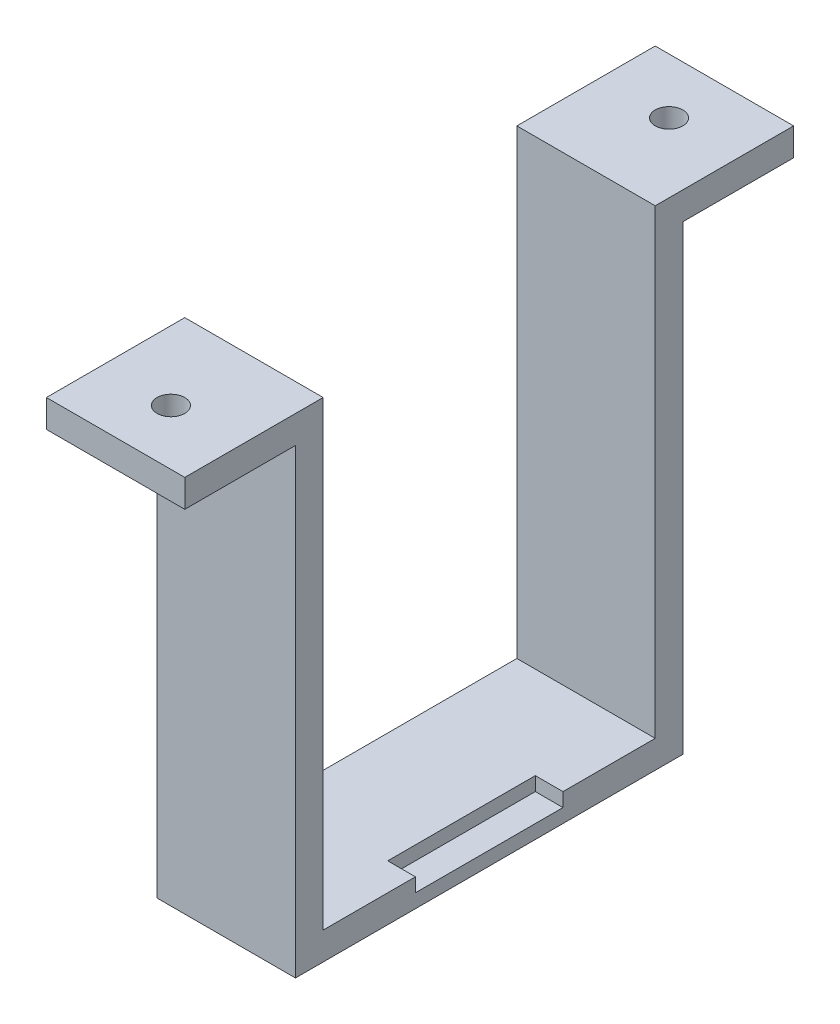
from build123d import *

# Parameters (mm, degrees)
EXTRUDE_1_DEPTH     = 15
CUT_EXTRUDE_1_REACH = 63.758
SKETCH_2_R          = 1.5
SKETCH_3_W          = 16
SKETCH_3_H          = 1.5
CUT_EXTRUDE_2_DEPTH = 3


with BuildPart() as part:
    # 草图1 → 凸台-拉伸1 (new body)
    with BuildSketch(Plane(origin=(0, 0, 0), x_dir=(0, 0, -1), z_dir=(1, 0, 0))):
        Polygon((0, 0), (18, 0), (18, 50), (33, 50), (33, 47), (21, 47), (21, -3), (0, -3), (-21, -3), (-21, 47), (-33, 47), (-33, 50), (-18, 50), (-18, 0), align=None)
    extrude(amount=EXTRUDE_1_DEPTH)

    # 草图2 → 切除-拉伸1 (cut, up to next)
    with BuildSketch(Plane.XZ.offset(-47), mode=Mode.PRIVATE) as cut_extrude_1_sk1:
        with Locations(Location((7.5, -27, 0), (0, 0, 270))):
            Circle(SKETCH_2_R)
    cut_extrude_1_tool1 = extrude(cut_extrude_1_sk1.sketch, amount=-CUT_EXTRUDE_1_REACH, mode=Mode.PRIVATE) & part.part
    # 草图2 → 切除-拉伸1 (cut, up to next)
    with BuildSketch(Plane.XZ.offset(-47), mode=Mode.PRIVATE) as cut_extrude_1_sk2:
        with Locations(Location((7.5, 27, 0), (0, 0, 270))):
            Circle(SKETCH_2_R)
    cut_extrude_1_tool2 = extrude(cut_extrude_1_sk2.sketch, amount=-CUT_EXTRUDE_1_REACH, mode=Mode.PRIVATE) & part.part
    add(cut_extrude_1_tool1.solids().sort_by_distance((7.5, 47, -27))[0], mode=Mode.SUBTRACT)
    add(cut_extrude_1_tool2.solids().sort_by_distance((7.5, 47, 27))[0], mode=Mode.SUBTRACT)

    # 草图3 → 切除-拉伸2 (cut)
    with BuildSketch(Plane(origin=(15, 0, 0), x_dir=(0, 0, -1), z_dir=(1, 0, 0))):
        with Locations((0, -0.75)):
            Rectangle(SKETCH_3_W, SKETCH_3_H)
    extrude(amount=-CUT_EXTRUDE_2_DEPTH, mode=Mode.SUBTRACT)


solid = part.part
